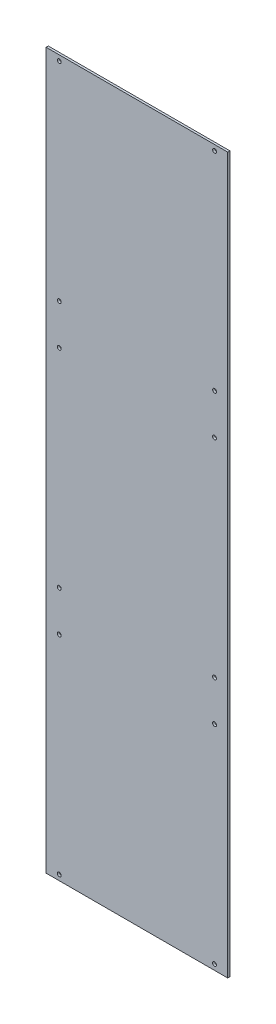
from build123d import *

# Parameters (mm, degrees)
SKETCH1_W              = 83
SKETCH1_H              = 327
BOSS_EXTRUDE1_DEPTH    = 0.5
M1_6_CLEARANCE_HOLE1_D = 1.8


with BuildPart() as part:
    # Sketch1 → Boss-Extrude1 (new, symmetric)
    with BuildSketch(Plane.XY):
        Rectangle(SKETCH1_W, SKETCH1_H)
    extrude(amount=BOSS_EXTRUDE1_DEPTH, both=True)

    # M1.6 Clearance Hole1 (through all)
    with Locations(Plane.XY.offset(0.5)):
        with Locations((-35.5, 161), (35.5, 161), (-35.5, 66), (35.5, 66), (-35.5, 47.5), (35.5, 47.5), (-35.5, -47.5), (35.5, -47.5), (-35.5, -66), (35.5, -66), (-35.5, -161), (35.5, -161)):
            Hole(M1_6_CLEARANCE_HOLE1_D / 2)


solid = part.part
